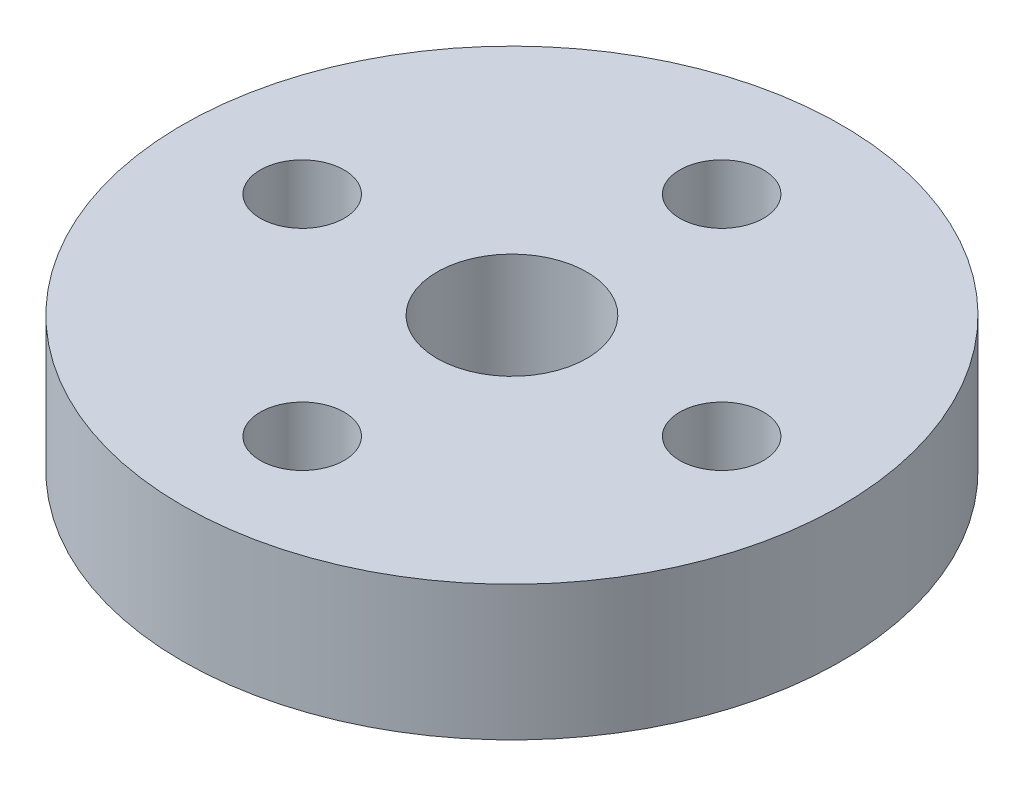
from build123d import *

# Parameters (mm, degrees)
SKETCH1_R           = 11
SKETCH1_R_2         = 2.5
SKETCH1_R_3         = 1.4
BOSS_EXTRUDE1_DEPTH = 4.5


with BuildPart() as part:
    # Sketch1 → Boss-Extrude1 (new body)
    with BuildSketch(Plane(origin=(0, 0, 0), x_dir=(1, 0, 0), z_dir=(0, 1, 0))):
        with Locations(Location((0, 0, 0), (0, 0, 270))):
            Circle(SKETCH1_R)
        with Locations(Location((0, 0, 0), (0, 0, 270))):
            Circle(SKETCH1_R_2, mode=Mode.SUBTRACT)
        with Locations(Location((0, 7, 0), (0, 0, 270))):
            Circle(SKETCH1_R_3, mode=Mode.SUBTRACT)
        with Locations(Location((7, 0, 0), (0, 0, 270))):
            Circle(SKETCH1_R_3, mode=Mode.SUBTRACT)
        with Locations(Location((0, -7, 0), (0, 0, 270))):
            Circle(SKETCH1_R_3, mode=Mode.SUBTRACT)
        with Locations(Location((-7, 0, 0), (0, 0, 270))):
            Circle(SKETCH1_R_3, mode=Mode.SUBTRACT)
    extrude(amount=BOSS_EXTRUDE1_DEPTH)


solid = part.part
